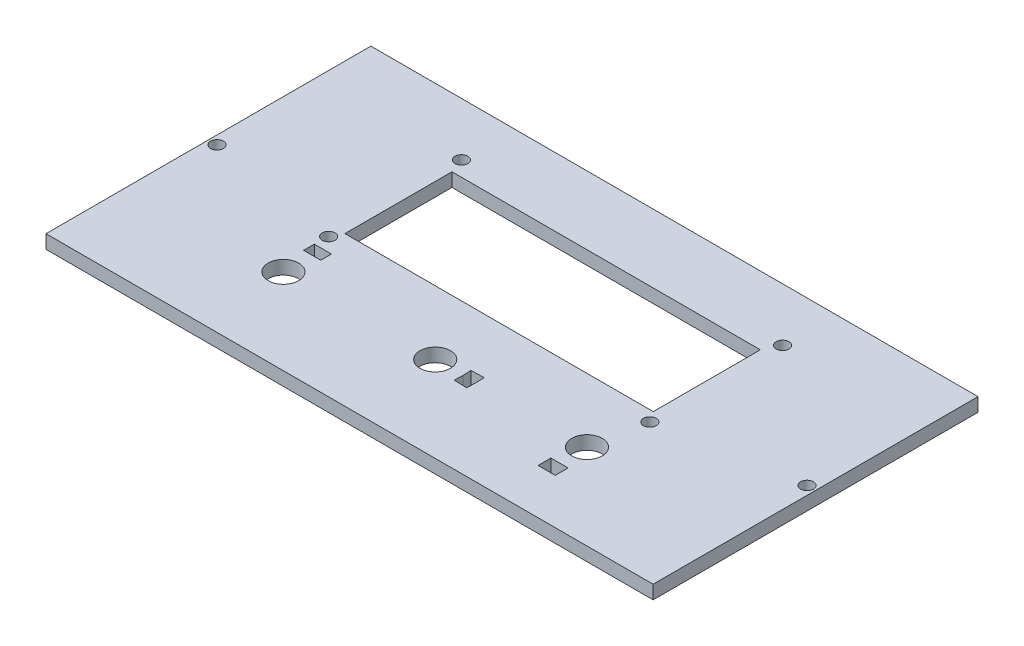
from build123d import *

# Parameters (mm, degrees)
SKETCH1_W           = 141.761639
SKETCH1_H           = 75.858415486
BOSS_EXTRUDE1_DEPTH = 3.175
SKETCH2_R           = 3.5625
CUT_EXTRUDE1_DEPTH  = 10
SKETCH3_W           = 72
SKETCH3_H           = 25
CUT_EXTRUDE2_DEPTH  = 10
SKETCH4_R           = 1.5
CUT_EXTRUDE3_DEPTH  = 10
SKETCH5_R           = 1.5
CUT_EXTRUDE4_DEPTH  = 10
SKETCH7_W           = 4
SKETCH7_H           = 2.5
SKETCH7_H_2         = 3
CUT_EXTRUDE5_DEPTH  = 10


with BuildPart() as part:
    # Sketch1 → Boss-Extrude1 (new body)
    with BuildSketch(Plane(origin=(0, 0, 0), x_dir=(1, 0, 0), z_dir=(0, 1, 0))):
        Rectangle(SKETCH1_W, SKETCH1_H)
    extrude(amount=BOSS_EXTRUDE1_DEPTH)

    # Sketch2 → Cut-Extrude1 (cut)
    with BuildSketch(Plane(origin=(0, 3.175, 0), x_dir=(1, 0, 0), z_dir=(0, 1, 0))):
        with Locations(Location((-35.4408195, -17.929207743, 0), (0, 0, 270))):
            Circle(SKETCH2_R)
        with Locations(Location((0, -17.929207743, 0), (0, 0, 270))):
            Circle(SKETCH2_R)
        with Locations(Location((35.4408195, -17.929207743, 0), (0, 0, 270))):
            Circle(SKETCH2_R)
    extrude(amount=-CUT_EXTRUDE1_DEPTH, mode=Mode.SUBTRACT)

    # Sketch3 → Cut-Extrude2 (cut)
    with BuildSketch(Plane(origin=(0, 3.175, 0), x_dir=(1, 0, 0), z_dir=(0, 1, 0))):
        with Locations((0, 9.485)):
            Rectangle(SKETCH3_W, SKETCH3_H)
    extrude(amount=-CUT_EXTRUDE2_DEPTH, mode=Mode.SUBTRACT)

    # Sketch4 → Cut-Extrude3 (cut)
    with BuildSketch(Plane(origin=(0, 3.175, 0), x_dir=(1, 0, 0), z_dir=(0, 1, 0))):
        with Locations(Location((37.7, 25.485, 0), (0, 0, 270))):
            Circle(SKETCH4_R)
        with Locations(Location((37.7, -5.515, 0), (0, 0, 270))):
            Circle(SKETCH4_R)
        with Locations(Location((-37.3, -5.515, 0), (0, 0, 270))):
            Circle(SKETCH4_R)
        with Locations(Location((-37.3, 25.485, 0), (0, 0, 270))):
            Circle(SKETCH4_R)
    extrude(amount=-CUT_EXTRUDE3_DEPTH, mode=Mode.SUBTRACT)

    # Sketch5 → Cut-Extrude4 (cut)
    with BuildSketch(Plane(origin=(0, 3.175, 0), x_dir=(1, 0, 0), z_dir=(0, 1, 0))):
        with Locations(Location((68.8808195, 0, 0), (0, 0, 270))):
            Circle(SKETCH5_R)
        with Locations(Location((-68.8808195, 0, 0), (0, 0, 270))):
            Circle(SKETCH5_R)
    extrude(amount=-CUT_EXTRUDE4_DEPTH, mode=Mode.SUBTRACT)

    # Sketch7 → Cut-Extrude5 (cut)
    with BuildSketch(Plane.XZ):
        with Locations((-35.4408195, 9.975414813)):
            Rectangle(SKETCH7_W, SKETCH7_H)
        Polygon((9.399912783, 19.969203639), (6.40097942, 19.889211847), (6.453259422, 17.929207743), (6.40097942, 15.969203639), (9.399912783, 15.889211847), (9.454326439, 17.929207743), align=None)
        with Locations((35.4408195, 25.849658905)):
            Rectangle(SKETCH7_W, SKETCH7_H_2)
    extrude(amount=-CUT_EXTRUDE5_DEPTH, mode=Mode.SUBTRACT)


solid = part.part
